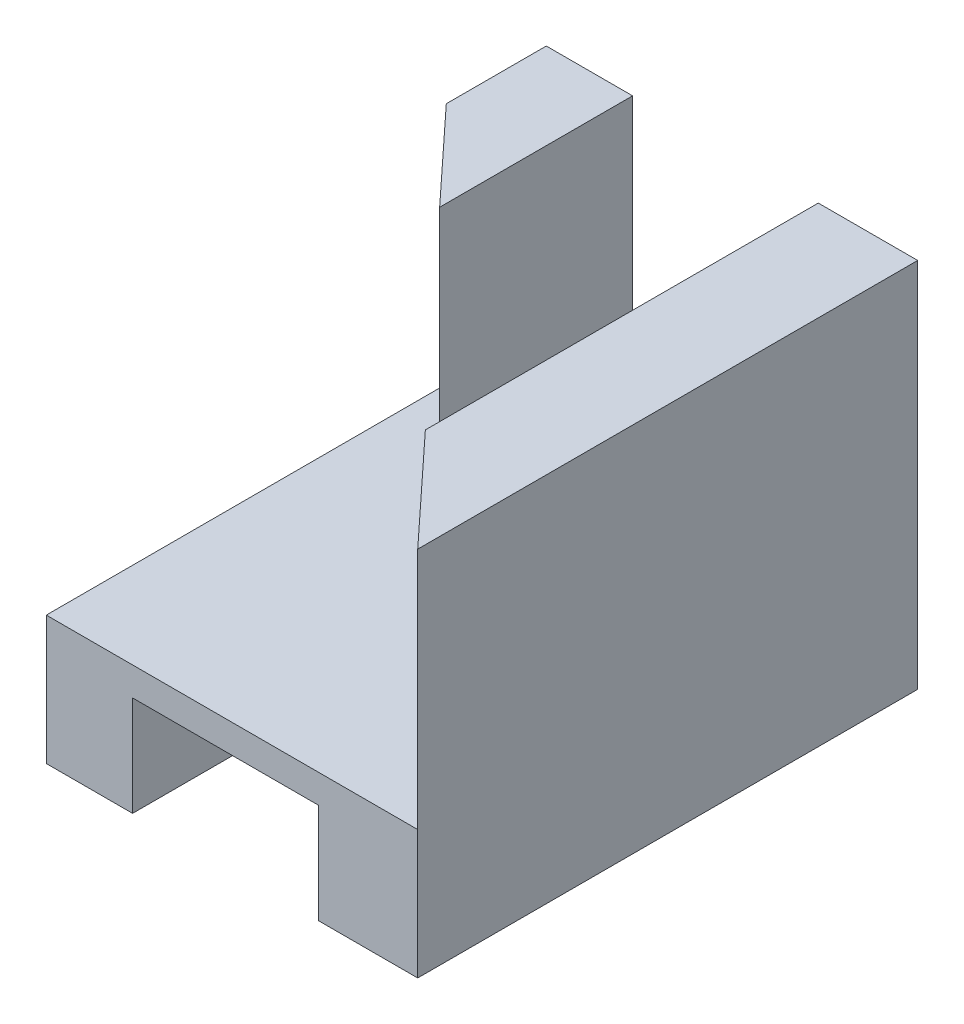
from build123d import *

# Parameters (mm, degrees)
EXTRUDE_1_DEPTH     = 35
CUT_EXTRUDE_1_DEPTH = 17


with BuildPart() as part:
    # 草圖1 → 填料-伸長1 (new body)
    with BuildSketch(Plane.XY):
        Polygon((-6.958874233, 13), (-6.958874233, 0), (6.041125767, 0), (6.041125767, 13), (13, 13), (13, -13), (6.041125767, -13), (6.041125767, -6), (-6.958874233, -6), (-6.958874233, -13), (-13, -13), (-13, 13), align=None)
    extrude(amount=EXTRUDE_1_DEPTH)

    # 草圖2 → 除料-伸長1 (cut)
    with BuildSketch(Plane(origin=(0, 13, 0), x_dir=(1, 0, 0), z_dir=(0, 1, 0))):
        Polygon((13, -35), (-6.958874233, -13.50582775), (-6.958874233, -35), align=None)
        Polygon((-6.958874233, -13.50582775), (-13, -7), (-13, -35), (-6.958874233, -35), align=None)
    extrude(amount=-CUT_EXTRUDE_1_DEPTH, mode=Mode.SUBTRACT)


solid = part.part
